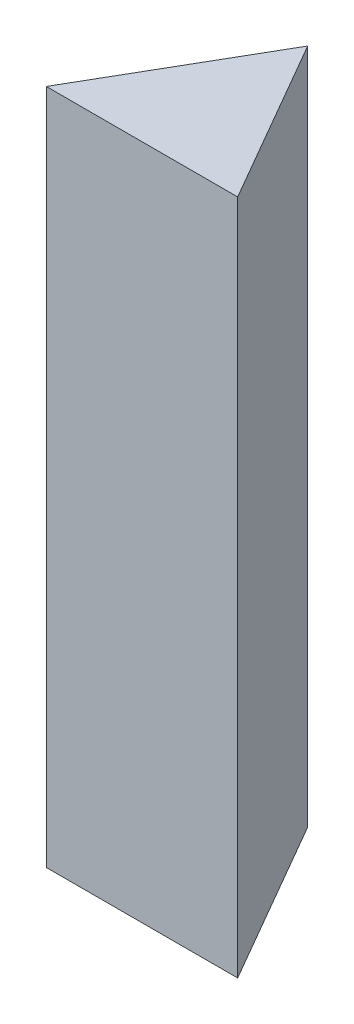
from build123d import *

# Parameters (mm, degrees)
BOSS_EXTRUDE1_DEPTH = 15


with BuildPart() as part:
    # Sketch1 → Boss-Extrude1 (new body)
    with BuildSketch(Plane(origin=(0, 0, 0), x_dir=(1, 0, 0), z_dir=(0, 1, 0))):
        Polygon((-2.121762239, -1.225), (2.121762239, -1.225), (0, 2.45), align=None)
    extrude(amount=BOSS_EXTRUDE1_DEPTH)


solid = part.part
